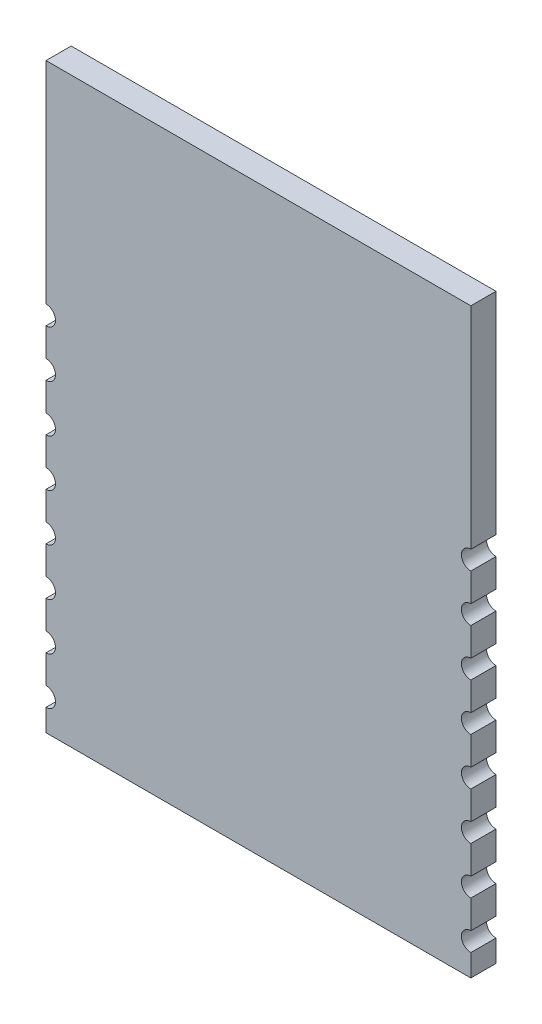
from build123d import *

# Parameters (mm, degrees)
ESBO_O1_W                 = 13.5
ESBO_O1_H                 = 18.5
RESSALTO_EXTRUS_O1_DEPTH  = 0.8
ESBO_O2_R                 = 0.3
CORTE_EXTRUS_O1_DEPTH     = 23.915933322
PADR_O_LINEAR1_COUNT      = 8
PADR_O_LINEAR1_PITCH      = 1.5
ESPELHAR1_COPY_1_SKETCH_R = 0.3
ESPELHAR1_COPY_1_DEPTH    = 23.915933322
ESPELHAR1_COPY_2_SKETCH_R = 0.3
ESPELHAR1_COPY_2_DEPTH    = 23.915933322
ESPELHAR1_COPY_3_SKETCH_R = 0.3
ESPELHAR1_COPY_3_DEPTH    = 23.915933322
ESPELHAR1_COPY_4_SKETCH_R = 0.3
ESPELHAR1_COPY_4_DEPTH    = 23.915933322
ESPELHAR1_COPY_5_SKETCH_R = 0.3
ESPELHAR1_COPY_5_DEPTH    = 23.915933322
ESPELHAR1_COPY_6_SKETCH_R = 0.3
ESPELHAR1_COPY_6_DEPTH    = 23.915933322
ESPELHAR1_COPY_7_SKETCH_R = 0.3
ESPELHAR1_COPY_7_DEPTH    = 23.915933322


with BuildPart() as part:
    # Esboço1 → Ressalto-extrusão1 (new body)
    with BuildSketch(Plane.XY):
        with Locations((6.75, 9.25)):
            Rectangle(ESBO_O1_W, ESBO_O1_H)
    extrude(amount=RESSALTO_EXTRUS_O1_DEPTH)

    # Esboço2 → Corte-extrusão1 (cut, through all)
    with BuildSketch(Plane.XY.offset(0.8)):
        with Locations((13.5, 1)):
            Circle(ESBO_O2_R)
    corte_extrus_o1 = extrude(amount=-CORTE_EXTRUS_O1_DEPTH, mode=Mode.SUBTRACT)

    # Padrão linear1: Corte-extrusão1 ×8
    with Locations(*[(0, i * PADR_O_LINEAR1_PITCH, 0) for i in range(1, PADR_O_LINEAR1_COUNT)]):
        add(corte_extrus_o1, mode=Mode.SUBTRACT)

    # Espelhar1: Corte-extrusão1 across plane
    add(corte_extrus_o1.mirror(Plane.ZY.offset(-6.75)), mode=Mode.SUBTRACT)

    # Espelhar1 copy 1 sketch → Espelhar1 copy 1 (cut, through all)
    with BuildSketch(Plane(origin=(13.5, 1.5, 0.8), x_dir=(-1, 0, 0), z_dir=(0, 0, 1))):
        with Locations((13.5, -1)):
            Circle(ESPELHAR1_COPY_1_SKETCH_R)
    extrude(amount=-ESPELHAR1_COPY_1_DEPTH, mode=Mode.SUBTRACT)

    # Espelhar1 copy 2 sketch → Espelhar1 copy 2 (cut, through all)
    with BuildSketch(Plane(origin=(13.5, 3, 0.8), x_dir=(-1, 0, 0), z_dir=(0, 0, 1))):
        with Locations((13.5, -1)):
            Circle(ESPELHAR1_COPY_2_SKETCH_R)
    extrude(amount=-ESPELHAR1_COPY_2_DEPTH, mode=Mode.SUBTRACT)

    # Espelhar1 copy 3 sketch → Espelhar1 copy 3 (cut, through all)
    with BuildSketch(Plane(origin=(13.5, 4.5, 0.8), x_dir=(-1, 0, 0), z_dir=(0, 0, 1))):
        with Locations((13.5, -1)):
            Circle(ESPELHAR1_COPY_3_SKETCH_R)
    extrude(amount=-ESPELHAR1_COPY_3_DEPTH, mode=Mode.SUBTRACT)

    # Espelhar1 copy 4 sketch → Espelhar1 copy 4 (cut, through all)
    with BuildSketch(Plane(origin=(13.5, 6, 0.8), x_dir=(-1, 0, 0), z_dir=(0, 0, 1))):
        with Locations((13.5, -1)):
            Circle(ESPELHAR1_COPY_4_SKETCH_R)
    extrude(amount=-ESPELHAR1_COPY_4_DEPTH, mode=Mode.SUBTRACT)

    # Espelhar1 copy 5 sketch → Espelhar1 copy 5 (cut, through all)
    with BuildSketch(Plane(origin=(13.5, 7.5, 0.8), x_dir=(-1, 0, 0), z_dir=(0, 0, 1))):
        with Locations((13.5, -1)):
            Circle(ESPELHAR1_COPY_5_SKETCH_R)
    extrude(amount=-ESPELHAR1_COPY_5_DEPTH, mode=Mode.SUBTRACT)

    # Espelhar1 copy 6 sketch → Espelhar1 copy 6 (cut, through all)
    with BuildSketch(Plane(origin=(13.5, 9, 0.8), x_dir=(-1, 0, 0), z_dir=(0, 0, 1))):
        with Locations((13.5, -1)):
            Circle(ESPELHAR1_COPY_6_SKETCH_R)
    extrude(amount=-ESPELHAR1_COPY_6_DEPTH, mode=Mode.SUBTRACT)

    # Espelhar1 copy 7 sketch → Espelhar1 copy 7 (cut, through all)
    with BuildSketch(Plane(origin=(13.5, 10.5, 0.8), x_dir=(-1, 0, 0), z_dir=(0, 0, 1))):
        with Locations((13.5, -1)):
            Circle(ESPELHAR1_COPY_7_SKETCH_R)
    extrude(amount=-ESPELHAR1_COPY_7_DEPTH, mode=Mode.SUBTRACT)


solid = part.part
